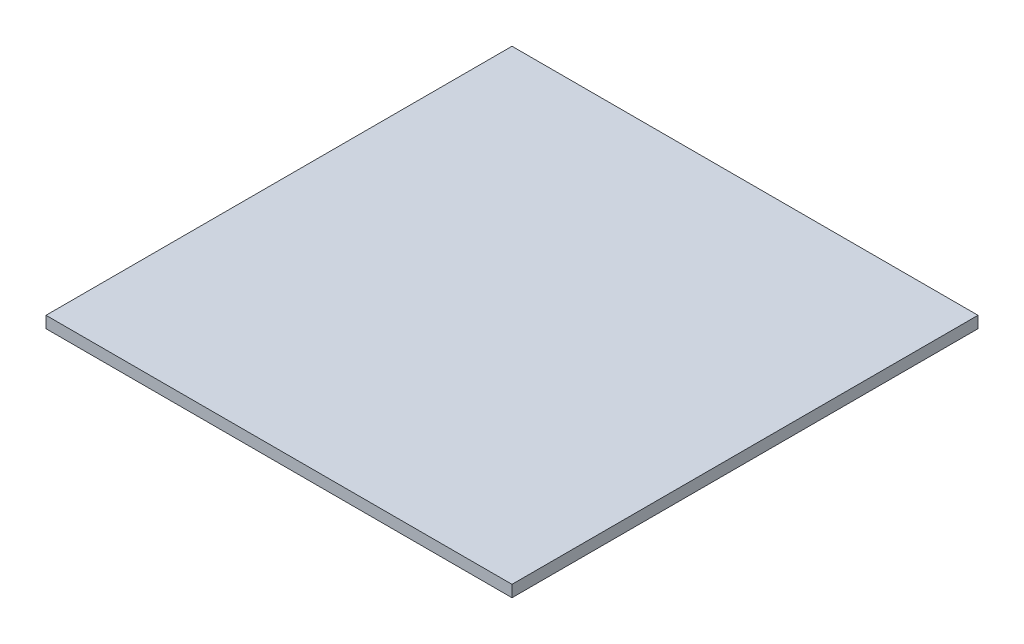
from build123d import *

# Parameters (mm, degrees)
SKETCH_2_W      = 4000
SKETCH_2_H      = 4000
EXTRUDE_1_DEPTH = 100


with BuildPart() as part:
    # 草图2 → 凸台-拉伸1 (new body)
    with BuildSketch(Plane(origin=(0, 0, 0), x_dir=(1, 0, 0), z_dir=(0, 1, 0))):
        Rectangle(SKETCH_2_W, SKETCH_2_H)
    extrude(amount=EXTRUDE_1_DEPTH)


solid = part.part
